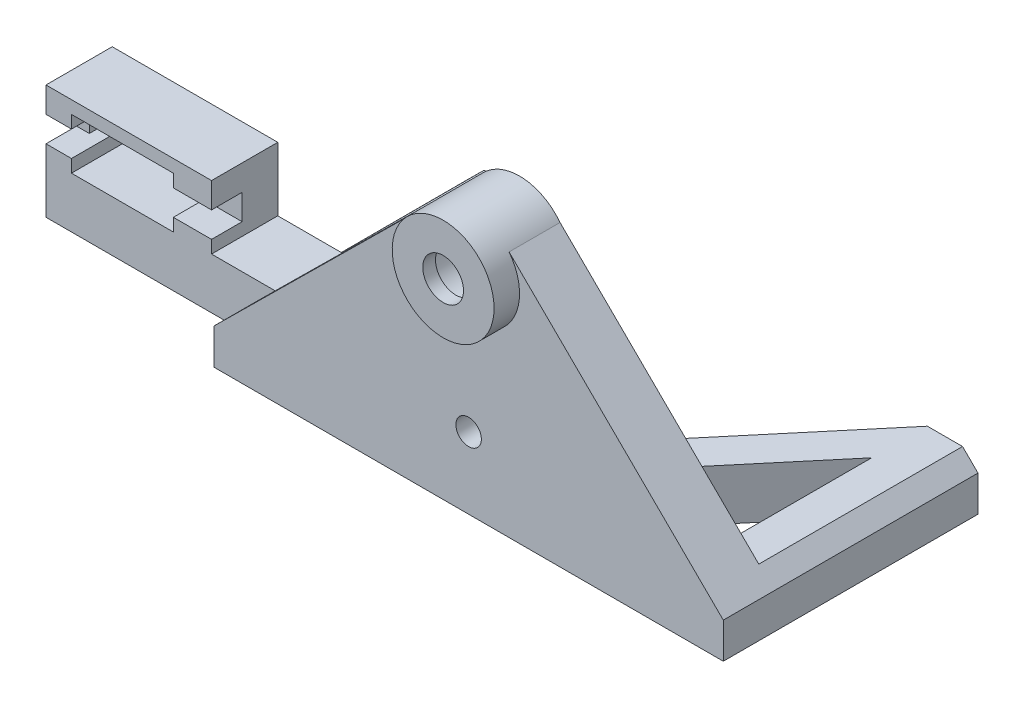
from build123d import *

# Parameters (mm, degrees)
SKETCH1_W           = 200
SKETCH1_H           = 100
BOSS_EXTRUDE1_DEPTH = 50
CUT_EXTRUDE1_DEPTH  = 174.205080757
SKETCH3_W           = 80
SKETCH3_H           = 80
CUT_EXTRUDE2_DEPTH  = 230.128784748
CUT_EXTRUDE3_DEPTH  = 100
SKETCH6_R           = 5
CUT_EXTRUDE5_DEPTH  = 100
BOSS_EXTRUDE2_DEPTH = 25
CUT_EXTRUDE6_START  = -35
SKETCH8_R           = 11
CUT_EXTRUDE6_DEPTH  = 35
SKETCH9_R           = 20
SKETCH9_R_2         = 8
BOSS_EXTRUDE3_DEPTH = 5
SKETCH10_W          = 90
SKETCH10_H          = 26
BOSS_EXTRUDE4_DEPTH = 20
SKETCH11_W          = 10
SKETCH11_H          = 26
SKETCH11_W_2        = 15
BOSS_EXTRUDE5_DEPTH = 20
SKETCH12_W          = 65
SKETCH12_H          = 10
CUT_EXTRUDE7_DEPTH  = 12
SKETCH13_W          = 65
SKETCH13_H          = 26
BOSS_EXTRUDE6_DEPTH = 5
CUT_EXTRUDE8_DEPTH  = 35


with BuildPart() as part:
    # Sketch1 → Boss-Extrude1 (new, symmetric)
    with BuildSketch(Plane.XY):
        with Locations((0, 50)):
            Rectangle(SKETCH1_W, SKETCH1_H)
    extrude(amount=BOSS_EXTRUDE1_DEPTH, both=True)

    # Sketch2 → Cut-Extrude1 (cut, through all)
    with BuildSketch(Plane.XY.offset(50)):
        Polygon((-13, 100), (-100, 14), (-100, 100), align=None)
        Polygon((100, 14), (100, 100), (13, 100), align=None)
    extrude(amount=-CUT_EXTRUDE1_DEPTH, mode=Mode.SUBTRACT)

    # Sketch3 → Cut-Extrude2 (cut, through all)
    with BuildSketch(Plane.ZY.offset(100)):
        with Locations((-10, 60)):
            Rectangle(SKETCH3_W, SKETCH3_H)
    extrude(amount=-CUT_EXTRUDE2_DEPTH, mode=Mode.SUBTRACT)

    # Sketch4 → Cut-Extrude3 (cut)
    with BuildSketch(Plane(origin=(0, 20, 0), x_dir=(1, 0, 0), z_dir=(0, 1, 0))):
        Polygon((80.127970494, 50), (13, -30), (-13, -30), (-80.127970494, 50), align=None)
        Polygon((79.930232558, -30), (31, -30), (79.930232558, 28.312780438), align=None)
        Polygon((-79.930232558, -30), (-31, -30), (-79.930232558, 28.312780438), align=None)
    extrude(amount=-CUT_EXTRUDE3_DEPTH, mode=Mode.SUBTRACT)

    # Sketch6 → Cut-Extrude5 (cut)
    with BuildSketch(Plane(origin=(0, 0, 30), x_dir=(-1, 0, 0), z_dir=(0, 0, -1))):
        with Locations((0, 28)):
            Circle(SKETCH6_R)
    extrude(amount=-CUT_EXTRUDE5_DEPTH, mode=Mode.SUBTRACT)

    # Sketch5 → Boss-Extrude2 (add)
    with BuildSketch(Plane(origin=(0, 0, 30), x_dir=(-1, 0, 0), z_dir=(0, 0, -1))):
        with BuildLine():
            ThreePointArc((15.89644113, 97.136851297), (0, 105), (-15.89644113, 97.136851297))
            Line((-15.89644113, 97.136851297), (-13, 100))
            Line((-13, 100), (0, 100))
            Line((0, 100), (13, 100))
            Line((13, 100), (15.89644113, 97.136851297))
        make_face()
        with BuildLine():
            ThreePointArc((-15.89644113, 97.136851297), (-17.926754111, 76.132560289), (0, 65))
            Line((0, 65), (0, 74))
            ThreePointArc((0, 74), (-11, 85), (0, 96))
            Line((0, 96), (0, 100))
            Line((0, 100), (-13, 100))
            Line((-13, 100), (-15.89644113, 97.136851297))
        make_face()
        with BuildLine():
            Line((0, 74), (0, 65))
            ThreePointArc((0, 65), (14.142135624, 70.857864376), (20, 85))
            ThreePointArc((20, 85), (18.946356148, 91.405902645), (15.89644113, 97.136851297))
            Line((15.89644113, 97.136851297), (13, 100))
            Line((13, 100), (0, 100))
            Line((0, 100), (0, 96))
            ThreePointArc((0, 96), (7.778174593, 92.778174593), (11, 85))
            ThreePointArc((11, 85), (7.778174593, 77.221825407), (0, 74))
        make_face()
    extrude(amount=-BOSS_EXTRUDE2_DEPTH)

    # Sketch8 → Cut-Extrude6 (cut)
    with BuildSketch(Plane.XY.offset(55).offset(CUT_EXTRUDE6_START)):
        with Locations((0, 85)):
            Circle(SKETCH8_R)
    extrude(amount=CUT_EXTRUDE6_DEPTH, mode=Mode.SUBTRACT)

    # Sketch9 → Boss-Extrude3 (add)
    with BuildSketch(Plane.XY.offset(55)):
        with Locations((0, 85)):
            Circle(SKETCH9_R)
        with Locations((0, 85)):
            Circle(SKETCH9_R_2, mode=Mode.SUBTRACT)
    extrude(amount=BOSS_EXTRUDE3_DEPTH)

    # Sketch10 → Boss-Extrude4 (add)
    with BuildSketch(Plane(origin=(0, 20, 0), x_dir=(1, 0, 0), z_dir=(0, 1, 0))):
        with Locations((-138.930232558, -19)):
            Rectangle(SKETCH10_W, SKETCH10_H)
    extrude(amount=-BOSS_EXTRUDE4_DEPTH)

    # Sketch11 → Boss-Extrude5 (add)
    with BuildSketch(Plane(origin=(0, 20, 0), x_dir=(1, 0, 0), z_dir=(0, 1, 0))):
        with Locations((-178.930232558, -19)):
            Rectangle(SKETCH11_W, SKETCH11_H)
        with Locations((-126.430232558, -19)):
            Rectangle(SKETCH11_W_2, SKETCH11_H)
    extrude(amount=BOSS_EXTRUDE5_DEPTH)

    # Sketch12 → Cut-Extrude7 (cut)
    with BuildSketch(Plane.XY.offset(32)):
        with Locations((-151.430232558, 30)):
            Rectangle(SKETCH12_W, SKETCH12_H)
    extrude(amount=-CUT_EXTRUDE7_DEPTH, mode=Mode.SUBTRACT)

    # Sketch13 → Boss-Extrude6 (add)
    with BuildSketch(Plane(origin=(0, 40, 0), x_dir=(1, 0, 0), z_dir=(0, 1, 0))):
        with Locations((-151.430232558, -19)):
            Rectangle(SKETCH13_W, SKETCH13_H)
    extrude(amount=BOSS_EXTRUDE6_DEPTH)

    # Sketch14 → Cut-Extrude8 (cut)
    with BuildSketch(Plane.XY.offset(20)):
        Polygon((-133.930232558, 25), (-128.930232558, 25), (-128.930232558, 35), (-133.930232558, 35), (-178.930232558, 35), (-178.930232558, 25), align=None)
    extrude(amount=-CUT_EXTRUDE8_DEPTH, mode=Mode.SUBTRACT)


solid = part.part
